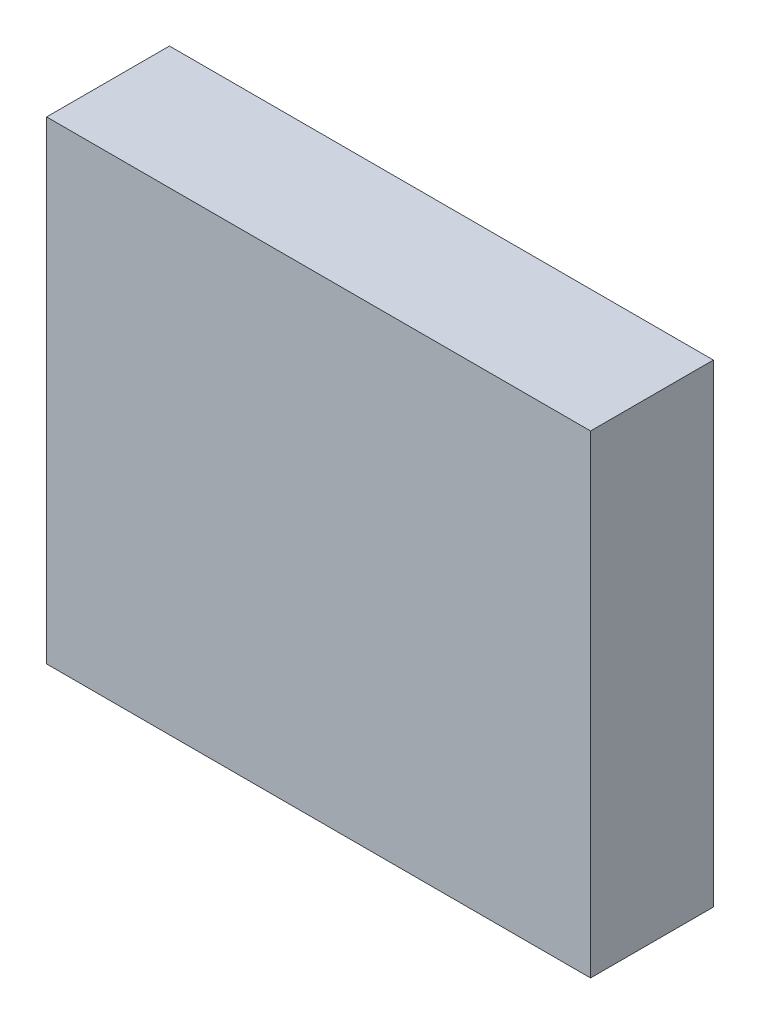
from build123d import *

# Parameters (mm, degrees)
SKETCH1_W           = 310
SKETCH1_H           = 270
BOSS_EXTRUDE1_DEPTH = 70


with BuildPart() as part:
    # Sketch1 → Boss-Extrude1 (new body)
    with BuildSketch(Plane.XY):
        Rectangle(SKETCH1_W, SKETCH1_H)
    extrude(amount=BOSS_EXTRUDE1_DEPTH)


solid = part.part
